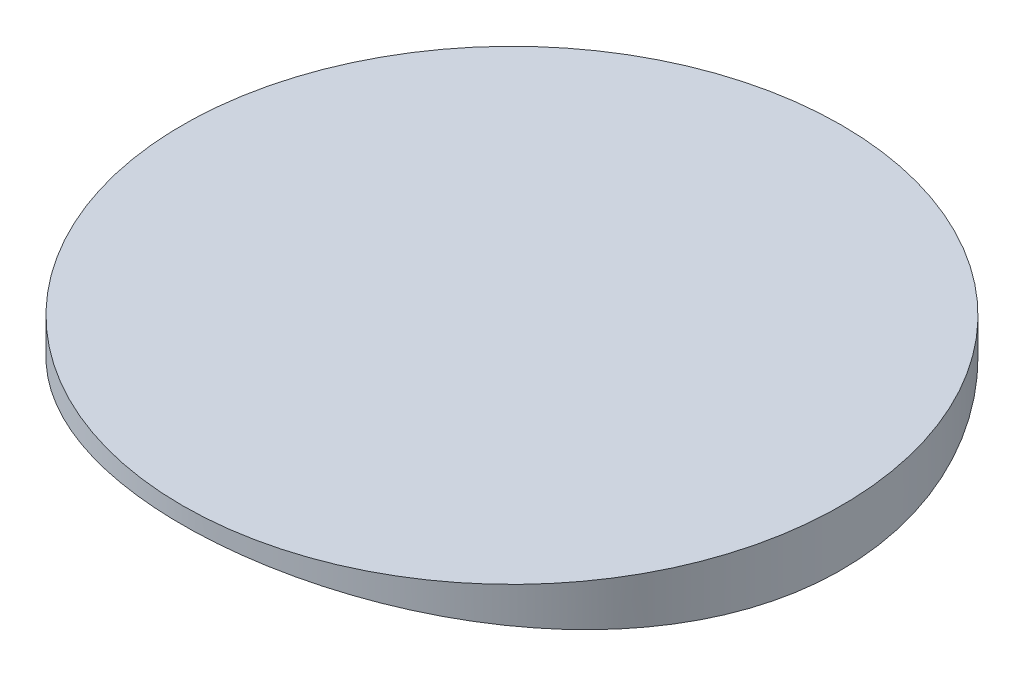
from build123d import *

# Parameters (mm, degrees)
SKETCH1_R               = 17.75
BOSS_EXTRUDE1_DEPTH     = 3
CUT_EXTRUDE2_DEPTH      = 26.28092166
CUT_EXTRUDE2_DEPTH_BACK = 26.28092166


with BuildPart() as part:
    # Sketch1 → Boss-Extrude1 (new body)
    with BuildSketch(Plane(origin=(0, 0, 0), x_dir=(1, 0, 0), z_dir=(0, 1, 0))):
        with Locations(Location((0, 0, 0), (0, 0, 270))):
            Circle(SKETCH1_R)
    extrude(amount=BOSS_EXTRUDE1_DEPTH)

    # Sketch2 → Cut-Extrude2 (cut, two sides: drawn at the far end of the back side and taken through both)
    with BuildSketch(Plane.XY.offset(-CUT_EXTRUDE2_DEPTH_BACK)):
        with BuildLine():
            Line((-17.75, 0), (17.75, 0))
            ThreePointArc((17.75, 0), (0, 2.0990034), (-17.75, 0))
        make_face()
    extrude(amount=CUT_EXTRUDE2_DEPTH + CUT_EXTRUDE2_DEPTH_BACK, mode=Mode.SUBTRACT)


solid = part.part
